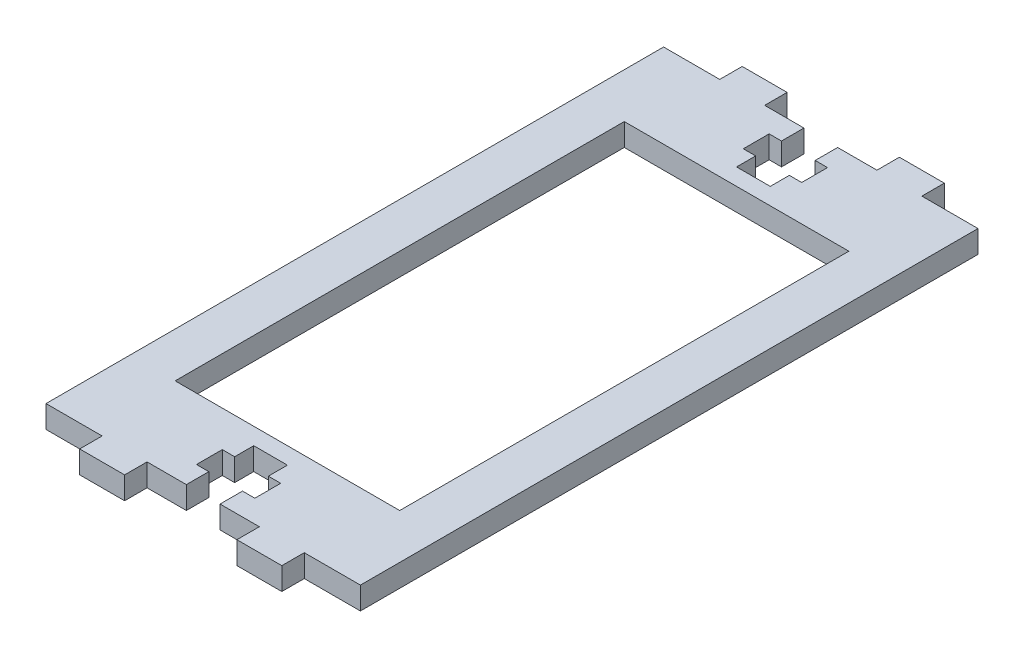
from build123d import *

# Parameters (mm, degrees)
SKETCH1_W           = 20
SKETCH1_H           = 40
BOSS_EXTRUDE1_DEPTH = 2
CUT_EXTRUDE2_DEPTH  = 2


with BuildPart() as part:
    # Sketch1 → Boss-Extrude1 (new body)
    with BuildSketch(Plane(origin=(0, 0, 0), x_dir=(1, 0, 0), z_dir=(0, 1, 0))):
        Polygon((-14, -27.5), (-9, -27.5), (-9, -29.5), (-5, -29.5), (-5, -27.5), (5, -27.5), (5, -29.5), (9, -29.5), (9, -27.5), (14, -27.5), (14, 27.5), (9, 27.5), (9, 29.5), (5, 29.5), (5, 27.5), (-5, 27.5), (-5, 29.5), (-9, 29.5), (-9, 27.5), (-14, 27.5), (-14, 14.5), (-14, -14.5), align=None)
        Rectangle(SKETCH1_W, SKETCH1_H, mode=Mode.SUBTRACT)
    extrude(amount=BOSS_EXTRUDE1_DEPTH)

    # Sketch4 → Cut-Extrude2 (cut)
    with BuildSketch(Plane(origin=(0, 2, 0), x_dir=(1, 0, 0), z_dir=(0, 1, 0))):
        Polygon((-1.5, 23.2), (-2.6, 23.2), (-2.6, 25.5), (-1.5, 25.5), (-1.5, 27.5), (1.5, 27.5), (1.5, 25.5), (2.6, 25.5), (2.6, 23.2), (1.5, 23.2), (1.5, 21.5), (-1.5, 21.5), align=None)
        Polygon((1.5, -25.5), (1.5, -27.5), (-1.5, -27.5), (-1.5, -25.5), (-2.6, -25.5), (-2.6, -23.2), (-1.5, -23.2), (-1.5, -21.5), (1.5, -21.5), (1.5, -23.2), (2.6, -23.2), (2.6, -25.5), align=None)
    extrude(amount=-CUT_EXTRUDE2_DEPTH, mode=Mode.SUBTRACT)


solid = part.part
